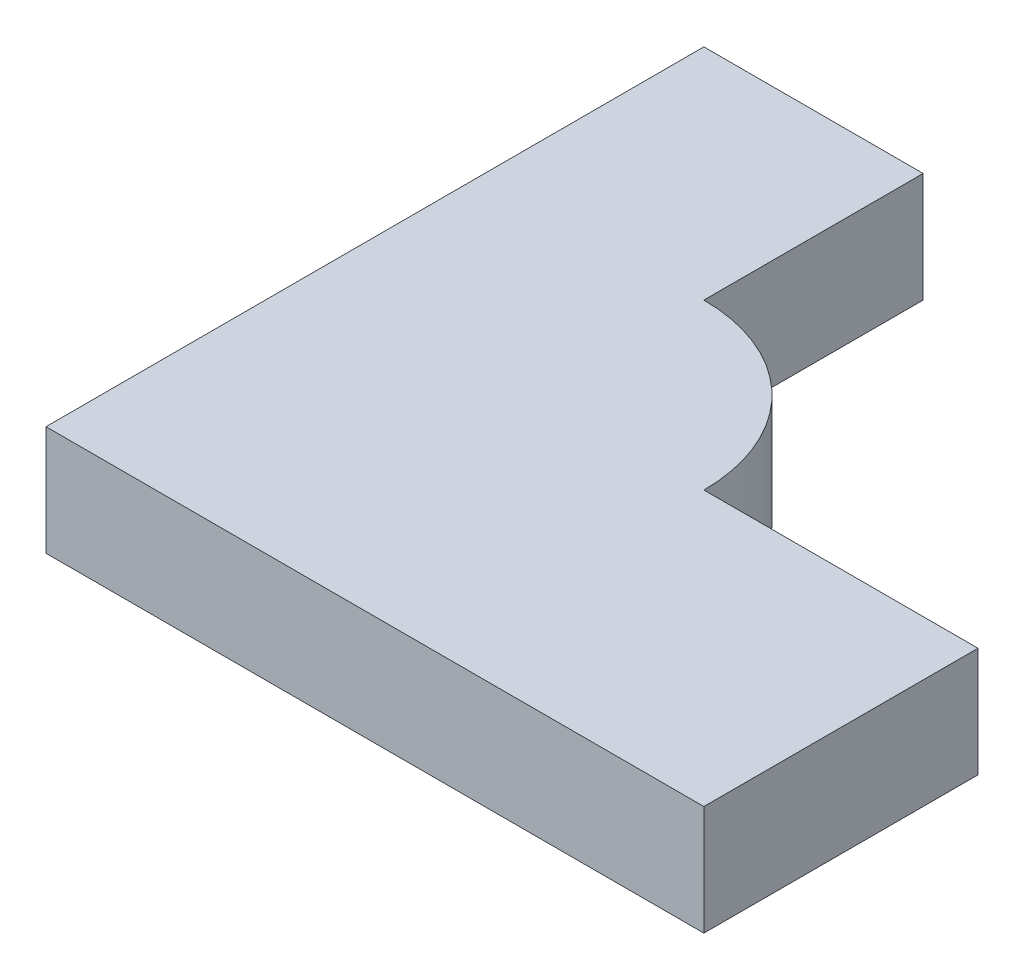
from build123d import *

# Parameters (mm, degrees)
BOSS_EXTRUDE1_DEPTH = 10


with BuildPart() as part:
    # Sketch1 → Boss-Extrude1 (new body)
    with BuildSketch(Plane(origin=(0, 0, 0), x_dir=(1, 0, 0), z_dir=(0, 1, 0))):
        with BuildLine():
            Line((0, 0), (60, 0))
            Line((60, 0), (60, 25))
            Line((60, 25), (35, 25))
            ThreePointArc((35, 25), (30.606601718, 35.606601718), (20, 40))
            Line((20, 40), (20, 60))
            Line((20, 60), (0, 60))
            Line((0, 60), (0, 0))
        make_face()
    extrude(amount=BOSS_EXTRUDE1_DEPTH)


solid = part.part
